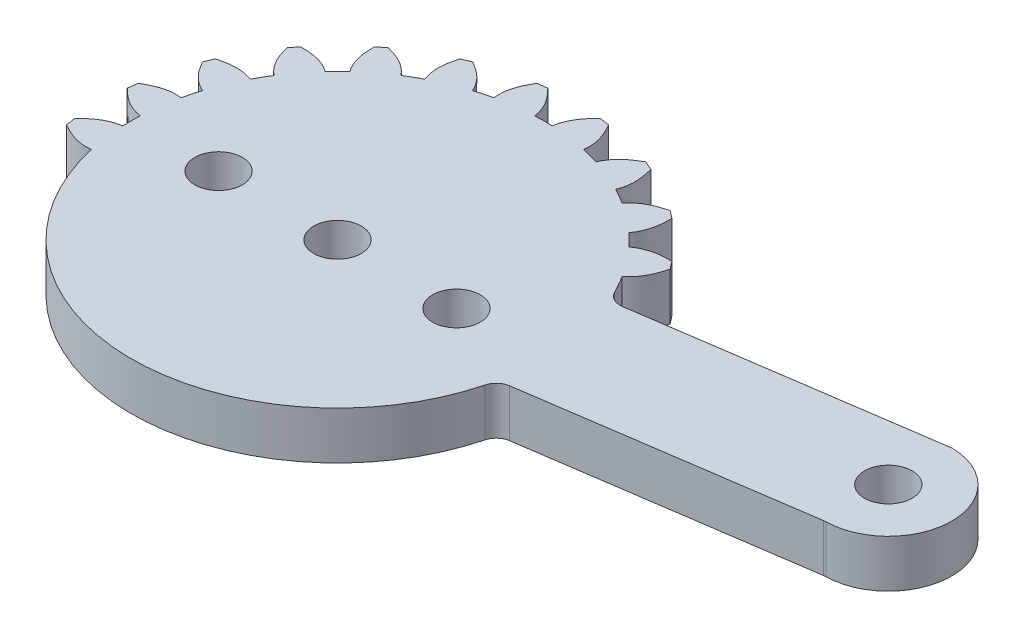
from build123d import *

# Parameters (mm, degrees)
SKETCH1_R           = 1.5
BOSS_EXTRUDE1_DEPTH = 3


with BuildPart() as part:
    # Sketch1 → Boss-Extrude1 (new body)
    with BuildSketch(Plane(origin=(0, 0, 0), x_dir=(1, 0, 0), z_dir=(0, 1, 0))):
        with BuildLine():
            Line((12.632699085, 5.340493617), (30.652467528, 7.988606141))
            ThreePointArc((30.652467528, 7.988606141), (30.736256439, 7.997332941), (30.820482547, 7.998976483))
            ThreePointArc((30.820482547, 7.998976483), (34.729974115, 3.985609874), (30.791707503, 0.000476005))
            ThreePointArc((30.791707503, 0.000476005), (30.726552312, -0.002657016), (30.661739998, -0.010031215))
            Line((30.661739998, -0.010031215), (13.400696346, -2.546644602))
            ThreePointArc((13.400696346, -2.546644602), (12.878710947, -2.791300832), (12.578512819, -3.283445639))
            ThreePointArc((12.578512819, -3.283445639), (0.316986254, -12.996134799), (-12.403478945, -3.892776652))
            add(Edge.make_bspline(
                [(-12.403478945, -3.892776652), (-12.568432388, -3.367671042), (-12.688169827, -2.830255546)],
                knots=[0, 0, 0, 0.029411494, 0.029411494, 0.029411494], degree=2))
            add(Edge.make_bspline(
                [(-12.688169827, -2.830255546), (-13.526378309, -2.92825021), (-14.200348489, -2.631756771), (-14.828036033, -2.264806262)],
                knots=[0, 0, 0, 0, 0.585569533, 0.585569533, 0.585569533, 0.585569533], degree=3))
            add(Edge.make_bspline(
                [(-14.828036033, -2.264806262), (-14.874848849, -1.958311002), (-14.908957951, -1.650143267)],
                knots=[0, 0, 0, 1, 1, 1], degree=2))
            add(Edge.make_bspline(
                [(-12.988354961, -0.550123072), (-13.823365068, -0.672411814), (-14.397632122, -1.133238803), (-14.908957951, -1.650143267)],
                knots=[0, 0, 0, 0, 0.585569533, 0.585569533, 0.585569533, 0.585569533], degree=3))
            add(Edge.make_bspline(
                [(-12.988354961, -0.550123072), (-13.003945727, -0.183508375), (-13.00394681, 0.183466584), (-12.988354961, 0.550123072)],
                knots=[0.090903106, 0.090903106, 0.090903106, 0.090903106, 0.120321184, 0.120321184, 0.120321184, 0.120321184], degree=3))
            add(Edge.make_bspline(
                [(-12.988354961, 0.550123072), (-13.823365068, 0.672411814), (-14.397632122, 1.133238803), (-14.908957951, 1.650143267)],
                knots=[0, 0, 0, 0, 0.585569533, 0.585569533, 0.585569533, 0.585569533], degree=3))
            add(Edge.make_bspline(
                [(-14.908957951, 1.650143267), (-14.874848849, 1.958311002), (-14.828036033, 2.264806262)],
                knots=[0, 0, 0, 1, 1, 1], degree=2))
            add(Edge.make_bspline(
                [(-12.688169827, 2.830255546), (-13.526378309, 2.92825021), (-14.200348489, 2.631756771), (-14.828036033, 2.264806262)],
                knots=[0, 0, 0, 0, 0.585569533, 0.585569533, 0.585569533, 0.585569533], degree=3))
            add(Edge.make_bspline(
                [(-12.688169827, 2.830255546), (-12.60833596, 3.18844173), (-12.513361148, 3.542894104), (-12.40340517, 3.893011712)],
                knots=[0.181812796, 0.181812796, 0.181812796, 0.181812796, 0.211230873, 0.211230873, 0.211230873, 0.211230873], degree=3))
            add(Edge.make_bspline(
                [(-12.40340517, 3.893011712), (-13.178312342, 4.227250084), (-13.613740919, 4.821006025), (-13.973859024, 5.452638259)],
                knots=[0, 0, 0, 0, 0.585569533, 0.585569533, 0.585569533, 0.585569533], degree=3))
            add(Edge.make_bspline(
                [(-13.973859024, 5.452638259), (-13.861152482, 5.741477348), (-13.736607963, 6.025412987)],
                knots=[0, 0, 0, 1, 1, 1], degree=2))
            add(Edge.make_bspline(
                [(-11.523306886, 6.017756925), (-12.307591221, 6.329356822), (-13.035334574, 6.217402469), (-13.736607963, 6.025412987)],
                knots=[0, 0, 0, 0, 0.585569533, 0.585569533, 0.585569533, 0.585569533], degree=3))
            add(Edge.make_bspline(
                [(-11.523306886, 6.017756925), (-11.35348747, 6.343077502), (-11.170010092, 6.660869731), (-10.973183814, 6.970598036)],
                knots=[0.272722485, 0.272722485, 0.272722485, 0.272722485, 0.302140562, 0.302140562, 0.302140562, 0.302140562], degree=3))
            add(Edge.make_bspline(
                [(-10.973183814, 6.970598036), (-11.635179408, 7.494008246), (-11.902095771, 8.180229653), (-12.086464697, 8.883544965)],
                knots=[0, 0, 0, 0, 0.585569533, 0.585569533, 0.585569533, 0.585569533], degree=3))
            add(Edge.make_bspline(
                [(-12.086464697, 8.883544965), (-11.90284148, 9.133371501), (-11.709052762, 9.375397774)],
                knots=[0, 0, 0, 1, 1, 1], degree=2))
            add(Edge.make_bspline(
                [(-9.573149625, 8.795158115), (-10.250062131, 9.299128225), (-10.981984149, 9.379342464), (-11.709052762, 9.375397774)],
                knots=[0, 0, 0, 0, 0.585569533, 0.585569533, 0.585569533, 0.585569533], degree=3))
            add(Edge.make_bspline(
                [(-9.573149625, 8.795158115), (-9.324917477, 9.065441278), (-9.065441275, 9.324917485), (-8.795158115, 9.573149625)],
                knots=[0.363632174, 0.363632174, 0.363632174, 0.363632174, 0.393050251, 0.393050251, 0.393050251, 0.393050251], degree=3))
            add(Edge.make_bspline(
                [(-8.795158115, 9.573149625), (-9.299128225, 10.250062131), (-9.379342464, 10.981984149), (-9.375397774, 11.709052762)],
                knots=[0, 0, 0, 0, 0.585569533, 0.585569533, 0.585569533, 0.585569533], degree=3))
            add(Edge.make_bspline(
                [(-9.375397774, 11.709052762), (-9.133371501, 11.90284148), (-8.883544965, 12.086464697)],
                knots=[0, 0, 0, 1, 1, 1], degree=2))
            add(Edge.make_bspline(
                [(-6.970598036, 10.973183814), (-7.494008246, 11.635179408), (-8.180229653, 11.902095771), (-8.883544965, 12.086464697)],
                knots=[0, 0, 0, 0, 0.585569533, 0.585569533, 0.585569533, 0.585569533], degree=3))
            add(Edge.make_bspline(
                [(-6.970598036, 10.973183814), (-6.660869762, 11.170010102), (-6.343077615, 11.353487483), (-6.017756925, 11.523306886)],
                knots=[0.454541863, 0.454541863, 0.454541863, 0.454541863, 0.48395994, 0.48395994, 0.48395994, 0.48395994], degree=3))
            add(Edge.make_bspline(
                [(-6.017756925, 11.523306886), (-6.329356822, 12.307591221), (-6.217402469, 13.035334574), (-6.025412987, 13.736607963)],
                knots=[0, 0, 0, 0, 0.585569533, 0.585569533, 0.585569533, 0.585569533], degree=3))
            add(Edge.make_bspline(
                [(-6.025412987, 13.736607963), (-5.741477348, 13.861152482), (-5.452638259, 13.973859024)],
                knots=[0, 0, 0, 1, 1, 1], degree=2))
            add(Edge.make_bspline(
                [(-3.893011712, 12.40340517), (-4.227250084, 13.178312342), (-4.821006025, 13.613740919), (-5.452638259, 13.973859024)],
                knots=[0, 0, 0, 0, 0.585569533, 0.585569533, 0.585569533, 0.585569533], degree=3))
            add(Edge.make_bspline(
                [(-3.893011712, 12.40340517), (-3.54289478, 12.513361188), (-3.188443695, 12.608336067), (-2.830255546, 12.688169827)],
                knots=[0.545451553, 0.545451553, 0.545451553, 0.545451553, 0.57486963, 0.57486963, 0.57486963, 0.57486963], degree=3))
            add(Edge.make_bspline(
                [(-2.830255546, 12.688169827), (-2.92825021, 13.526378309), (-2.631756771, 14.200348489), (-2.264806262, 14.828036033)],
                knots=[0, 0, 0, 0, 0.585569533, 0.585569533, 0.585569533, 0.585569533], degree=3))
            add(Edge.make_bspline(
                [(-2.264806262, 14.828036033), (-1.958311002, 14.874848849), (-1.650143267, 14.908957951)],
                knots=[0, 0, 0, 1, 1, 1], degree=2))
            add(Edge.make_bspline(
                [(-0.550123072, 12.988354961), (-0.672411814, 13.823365068), (-1.133238803, 14.397632122), (-1.650143267, 14.908957951)],
                knots=[0, 0, 0, 0, 0.585569533, 0.585569533, 0.585569533, 0.585569533], degree=3))
            add(Edge.make_bspline(
                [(-0.550123072, 12.988354961), (-0.183477364, 13.003947374), (0.183477419, 13.003947344), (0.550123072, 12.988354961)],
                knots=[0.636361242, 0.636361242, 0.636361242, 0.636361242, 0.665779319, 0.665779319, 0.665779319, 0.665779319], degree=3))
            add(Edge.make_bspline(
                [(0.550123072, 12.988354961), (0.672411814, 13.823365068), (1.133238803, 14.397632122), (1.650143267, 14.908957951)],
                knots=[0, 0, 0, 0, 0.585569533, 0.585569533, 0.585569533, 0.585569533], degree=3))
            add(Edge.make_bspline(
                [(1.650143267, 14.908957951), (1.958311002, 14.874848849), (2.264806262, 14.828036033)],
                knots=[0, 0, 0, 1, 1, 1], degree=2))
            add(Edge.make_bspline(
                [(2.830255546, 12.688169827), (2.92825021, 13.526378309), (2.631756771, 14.200348489), (2.264806262, 14.828036033)],
                knots=[0, 0, 0, 0, 0.585569533, 0.585569533, 0.585569533, 0.585569533], degree=3))
            add(Edge.make_bspline(
                [(2.830255546, 12.688169827), (3.188443874, 12.608335818), (3.542895259, 12.513360471), (3.893011712, 12.40340517)],
                knots=[0.727270931, 0.727270931, 0.727270931, 0.727270931, 0.756689008, 0.756689008, 0.756689008, 0.756689008], degree=3))
            add(Edge.make_bspline(
                [(3.893011712, 12.40340517), (4.227250084, 13.178312342), (4.821006025, 13.613740919), (5.452638259, 13.973859024)],
                knots=[0, 0, 0, 0, 0.585569533, 0.585569533, 0.585569533, 0.585569533], degree=3))
            add(Edge.make_bspline(
                [(5.452638259, 13.973859024), (5.741477348, 13.861152482), (6.025412987, 13.736607963)],
                knots=[0, 0, 0, 1, 1, 1], degree=2))
            add(Edge.make_bspline(
                [(6.017756925, 11.523306886), (6.329356822, 12.307591221), (6.217402469, 13.035334574), (6.025412987, 13.736607963)],
                knots=[0, 0, 0, 0, 0.585569533, 0.585569533, 0.585569533, 0.585569533], degree=3))
            add(Edge.make_bspline(
                [(6.017756925, 11.523306886), (6.343080162, 11.353483585), (6.660877044, 11.16999893), (6.970598036, 10.973183814)],
                knots=[0.81818062, 0.81818062, 0.81818062, 0.81818062, 0.847598697, 0.847598697, 0.847598697, 0.847598697], degree=3))
            add(Edge.make_bspline(
                [(6.970598036, 10.973183814), (7.494008246, 11.635179408), (8.180229653, 11.902095771), (8.883544965, 12.086464697)],
                knots=[0, 0, 0, 0, 0.585569533, 0.585569533, 0.585569533, 0.585569533], degree=3))
            add(Edge.make_bspline(
                [(8.883544965, 12.086464697), (9.133371501, 11.90284148), (9.375397774, 11.709052762)],
                knots=[0, 0, 0, 1, 1, 1], degree=2))
            add(Edge.make_bspline(
                [(8.795158115, 9.573149625), (9.299128225, 10.250062131), (9.379342464, 10.981984149), (9.375397774, 11.709052762)],
                knots=[0, 0, 0, 0, 0.585569533, 0.585569533, 0.585569533, 0.585569533], degree=3))
            add(Edge.make_bspline(
                [(8.795158115, 9.573149625), (9.065480928, 9.3248566), (9.325031193, 9.065266643), (9.573149625, 8.795158115)],
                knots=[0.909090309, 0.909090309, 0.909090309, 0.909090309, 0.938508386, 0.938508386, 0.938508386, 0.938508386], degree=3))
            add(Edge.make_bspline(
                [(9.573149625, 8.795158115), (10.250062131, 9.299128225), (10.981984149, 9.379342464), (11.709052762, 9.375397774)],
                knots=[0, 0, 0, 0, 0.585569533, 0.585569533, 0.585569533, 0.585569533], degree=3))
            add(Edge.make_bspline(
                [(11.709052762, 9.375397774), (11.90284148, 9.133371501), (12.086464697, 8.883544965)],
                knots=[0, 0, 0, 1, 1, 1], degree=2))
            add(Edge.make_bspline(
                [(10.973183814, 6.970598036), (11.635179408, 7.494008246), (11.902095771, 8.180229653), (12.086464697, 8.883544965)],
                knots=[0, 0, 0, 0, 0.585569533, 0.585569533, 0.585569533, 0.585569533], degree=3))
            ThreePointArc((10.973183814, 6.970598036), (11.297491618, 6.431693645), (11.595354368, 5.87773401))
            ThreePointArc((11.595354368, 5.87773401), (12.027420742, 5.441888374), (12.632699085, 5.340493617))
        make_face()
        with Locations(Location((0, 0, 0), (0, 0, 270))):
            Circle(SKETCH1_R, mode=Mode.SUBTRACT)
        with Locations(Location((7.5, 0, 0), (0, 0, 270))):
            Circle(SKETCH1_R, mode=Mode.SUBTRACT)
        with Locations(Location((-7.5, 0, 0), (0, 0, 270))):
            Circle(SKETCH1_R, mode=Mode.SUBTRACT)
        with Locations(Location((30.73, 4, 0), (0, 0, 270))):
            Circle(SKETCH1_R, mode=Mode.SUBTRACT)
    extrude(amount=BOSS_EXTRUDE1_DEPTH)


solid = part.part
